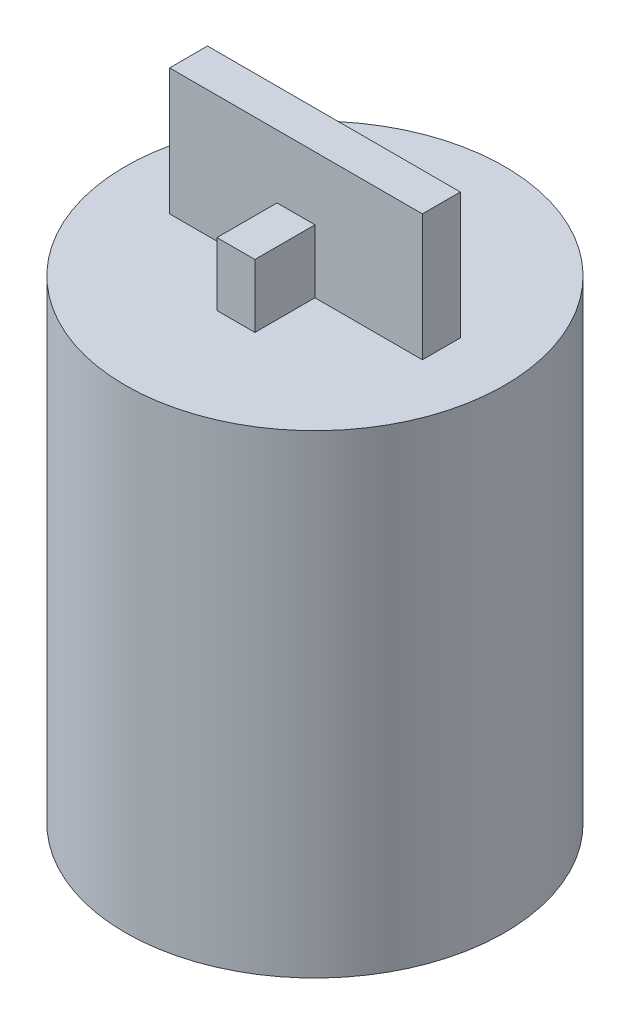
from build123d import *

# Parameters (mm, degrees)
SKETCH_1_W          = 4
SKETCH_1_H          = 0.6
EXTRUDE_1_DEPTH     = 2
SKETCH_1_3_W        = 0.6
SKETCH_1_3_H        = 2.5
EXTRUDE_2_DEPTH     = 1
SKETCH_1_4_R        = 3
EXTRUDE_3_DEPTH     = 7.5
CUT_EXTRUDE_1_DEPTH = 6.5


with BuildPart() as part:
    # 草图1 → 凸台-拉伸1 (new body)
    with BuildSketch(Plane(origin=(0, 0, 0), x_dir=(1, 0, 0), z_dir=(0, 1, 0))):
        Rectangle(SKETCH_1_W, SKETCH_1_H)
    extrude(amount=EXTRUDE_1_DEPTH)

    # 草图1<3> → 凸台-拉伸2 (add)
    with BuildSketch(Plane(origin=(0, 0, 0), x_dir=(1, 0, 0), z_dir=(0, 1, 0))):
        Rectangle(SKETCH_1_3_W, SKETCH_1_3_H)
    extrude(amount=EXTRUDE_2_DEPTH)

    # 草图1<4> → 凸台-拉伸3 (add)
    with BuildSketch(Plane(origin=(0, 0, 0), x_dir=(1, 0, 0), z_dir=(0, 1, 0))):
        with Locations(Location((0, 0, 0), (0, 0, 270))):
            Circle(SKETCH_1_4_R)
    extrude(amount=-EXTRUDE_3_DEPTH)

    # 草图2 → 切除-拉伸1 (cut)
    with BuildSketch(Plane.XZ.offset(7.5)):
        with BuildLine():
            ThreePointArc((-1.130029762, -2.230029762), (0, -2.5), (1.130029762, -2.230029762))
            Line((1.130029762, -2.230029762), (1.130029762, -1.130029762))
            Line((1.130029762, -1.130029762), (2.230029762, -1.130029762))
            ThreePointArc((2.230029762, -1.130029762), (2.5, 0), (2.230029762, 1.130029762))
            Line((2.230029762, 1.130029762), (1.130029762, 1.130029762))
            Line((1.130029762, 1.130029762), (1.130029762, 2.230029762))
            ThreePointArc((1.130029762, 2.230029762), (0, 2.5), (-1.130029762, 2.230029762))
            Line((-1.130029762, 2.230029762), (-1.130029762, 1.130029762))
            Line((-1.130029762, 1.130029762), (-2.230029762, 1.130029762))
            ThreePointArc((-2.230029762, 1.130029762), (-2.5, 0), (-2.230029762, -1.130029762))
            Line((-2.230029762, -1.130029762), (-1.130029762, -1.130029762))
            Line((-1.130029762, -1.130029762), (-1.130029762, -2.230029762))
        make_face()
    extrude(amount=-CUT_EXTRUDE_1_DEPTH, mode=Mode.SUBTRACT)


solid = part.part
